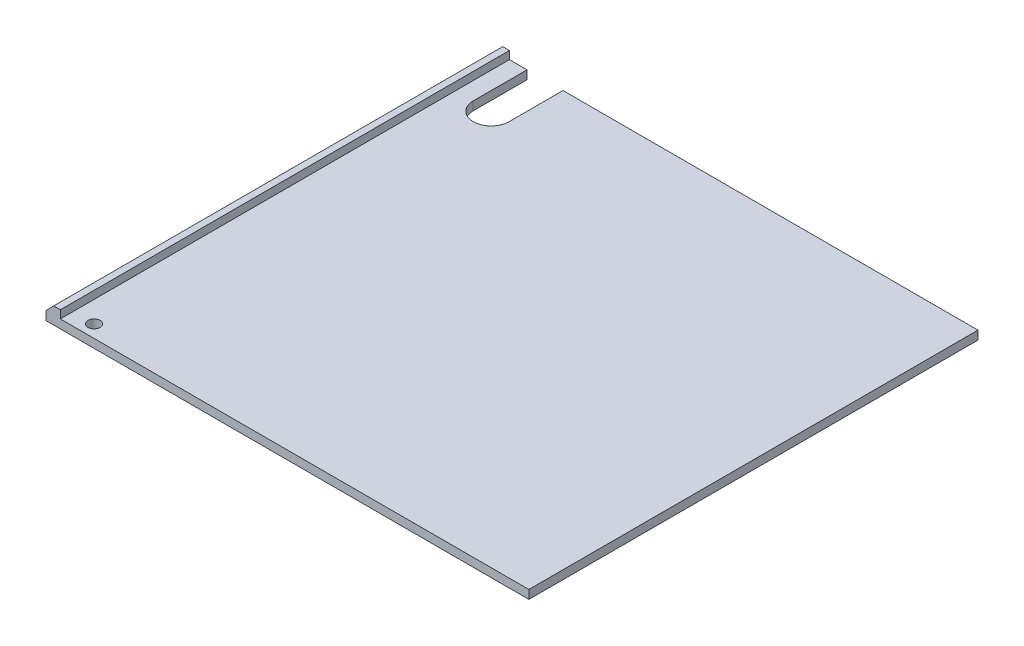
from build123d import *

# Parameters (mm, degrees)
SKETCH1_W           = 128.5
SKETCH1_H           = 125
BOSS_EXTRUDE1_DEPTH = 2.4
BOSS_EXTRUDE2_DEPTH = 125
CUT_EXTRUDE2_DEPTH  = 94.975369496
SKETCH6_R           = 1.7
CUT_EXTRUDE3_DEPTH  = 94.975369496


with BuildPart() as part:
    # Sketch1 → Boss-Extrude1 (new body)
    with BuildSketch(Plane(origin=(0, 0, 0), x_dir=(1, 0, 0), z_dir=(0, 1, 0))):
        Rectangle(SKETCH1_W, SKETCH1_H)
    extrude(amount=BOSS_EXTRUDE1_DEPTH)

    # Sketch3 → Boss-Extrude2 (add)
    with BuildSketch(Plane.XY.offset(62.5)):
        Polygon((-64.25, 2.4), (-66.05, 2.4), (-66.15, 2.4), (-66.15, 4.61), (-68.008287326, 4.61), (-70.138149903, 2.458869363), (-70.138149903, 0), (-64.25, 0), align=None)
    extrude(amount=-BOSS_EXTRUDE2_DEPTH)

    # Sketch5 → Cut-Extrude2 (cut, through all)
    with BuildSketch(Plane(origin=(0, 2.4, 0), x_dir=(1, 0, 0), z_dir=(0, 1, 0))):
        with BuildLine():
            Line((-51.25, 47.5), (-51.25, 62.5))
            Line((-51.25, 62.5), (-61.25, 62.5))
            Line((-61.25, 62.5), (-61.25, 47.5))
            ThreePointArc((-61.25, 47.5), (-56.25, 42.5), (-51.25, 47.5))
        make_face()
        with BuildLine():
            Line((-61.25, 62.5), (-51.25, 62.5))
            ThreePointArc((-51.25, 62.5), (-56.25, 67.5), (-61.25, 62.5))
        make_face()
    extrude(amount=-CUT_EXTRUDE2_DEPTH, mode=Mode.SUBTRACT)

    # Sketch6 → Cut-Extrude3 (cut, through all)
    with BuildSketch(Plane(origin=(0, 2.4, 0), x_dir=(1, 0, 0), z_dir=(0, 1, 0))):
        with Locations(Location((-60.25, -59, 0), (0, 0, 270))):
            Circle(SKETCH6_R)
    extrude(amount=-CUT_EXTRUDE3_DEPTH, mode=Mode.SUBTRACT)


solid = part.part
